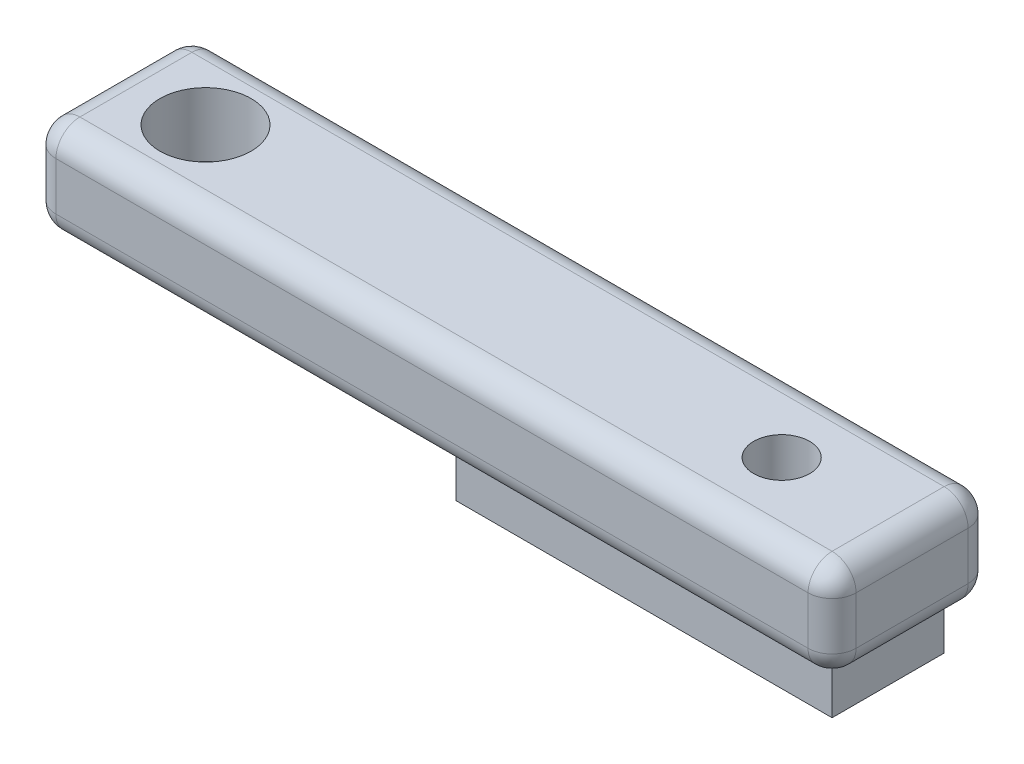
from build123d import *

# Parameters (mm, degrees)
SKETCH1_W               = 50
SKETCH1_H               = 10
BOSS_EXTRUDE1_DEPTH     = 6
SKETCH2_R               = 2.85
SKETCH2_R_2             = 1.5
CUT_EXTRUDE1_DEPTH      = 4
SKETCH3_R               = 1.5
CUT_EXTRUDE2_DEPTH      = 4
FILLET1_R               = 1.5
SKETCH6_W               = 23.5
SKETCH6_H               = 7
BOSS_EXTRUDE3_DEPTH     = 3.01
CUT_EXTRUDE4_DEPTH      = 27.191601707
CUT_EXTRUDE4_DEPTH_BACK = 27.191601707
SKETCH7_R               = 1.75
SKETCH8_R               = 1.5
CUT_EXTRUDE5_DEPTH      = 10


with BuildPart() as part:
    # Sketch1 → Boss-Extrude1 (new body)
    with BuildSketch(Plane(origin=(0, 0, 0), x_dir=(1, 0, 0), z_dir=(0, 1, 0))):
        Rectangle(SKETCH1_W, SKETCH1_H)
    extrude(amount=BOSS_EXTRUDE1_DEPTH)

    # Sketch2 → Cut-Extrude1 (cut)
    with BuildSketch(Plane(origin=(0, 6, 0), x_dir=(1, 0, 0), z_dir=(0, 1, 0))):
        with Locations(Location((-19.15, 0, 0), (0, 0, 270))):
            Circle(SKETCH2_R)
        with Locations(Location((16.85, 0, 0), (0, 0, 270))):
            Circle(SKETCH2_R_2)
    extrude(amount=-CUT_EXTRUDE1_DEPTH, mode=Mode.SUBTRACT)

    # Sketch3 → Cut-Extrude2 (cut)
    with BuildSketch(Plane(origin=(0, 2, 0), x_dir=(1, 0, 0), z_dir=(0, 1, 0))):
        with Locations(Location((16.85, 0, 0), (0, 0, 270))):
            Circle(SKETCH3_R)
    extrude(amount=-CUT_EXTRUDE2_DEPTH, mode=Mode.SUBTRACT)

    # Fillet1
    fillet1_edges = [part.edges().sort_by_distance(p)[0] for p in [
        (-25, 6, 0),
        (0, 6, 5),
        (25, 6, 0),
        (0, 0, 5),
        (-25, 0, 0),
        (0, 0, -5),
        (25, 0, 0),
        (25, 3, 5),
        (-25, 3, 5),
        (-25, 3, -5),
        (25, 3, -5),
        (0, 6, -5),
    ]]
    fillet(fillet1_edges, radius=FILLET1_R)

    # Sketch6 → Boss-Extrude3 (add)
    with BuildSketch(Plane.XZ):
        with Locations((11.75, 0)):
            Rectangle(SKETCH6_W, SKETCH6_H)
    extrude(amount=BOSS_EXTRUDE3_DEPTH)

    # Sketch7 → Cut-Extrude4 (cut, two sides: drawn at the far end of the back side and taken through both)
    with BuildSketch(Plane(origin=(0, 0, 0), x_dir=(1, 0, 0), z_dir=(0, 1, 0)).offset(-CUT_EXTRUDE4_DEPTH_BACK)):
        with Locations(Location((16.85, 0, 0), (0, 0, 270))):
            Circle(SKETCH7_R)
    extrude(amount=CUT_EXTRUDE4_DEPTH + CUT_EXTRUDE4_DEPTH_BACK, mode=Mode.SUBTRACT)

    # Sketch8 → Cut-Extrude5 (cut)
    with BuildSketch(Plane(origin=(0, 2, 0), x_dir=(1, 0, 0), z_dir=(0, 1, 0))):
        with Locations(Location((-19.15, 0, 0), (0, 0, 270))):
            Circle(SKETCH8_R)
    extrude(amount=-CUT_EXTRUDE5_DEPTH, mode=Mode.SUBTRACT)


solid = part.part
